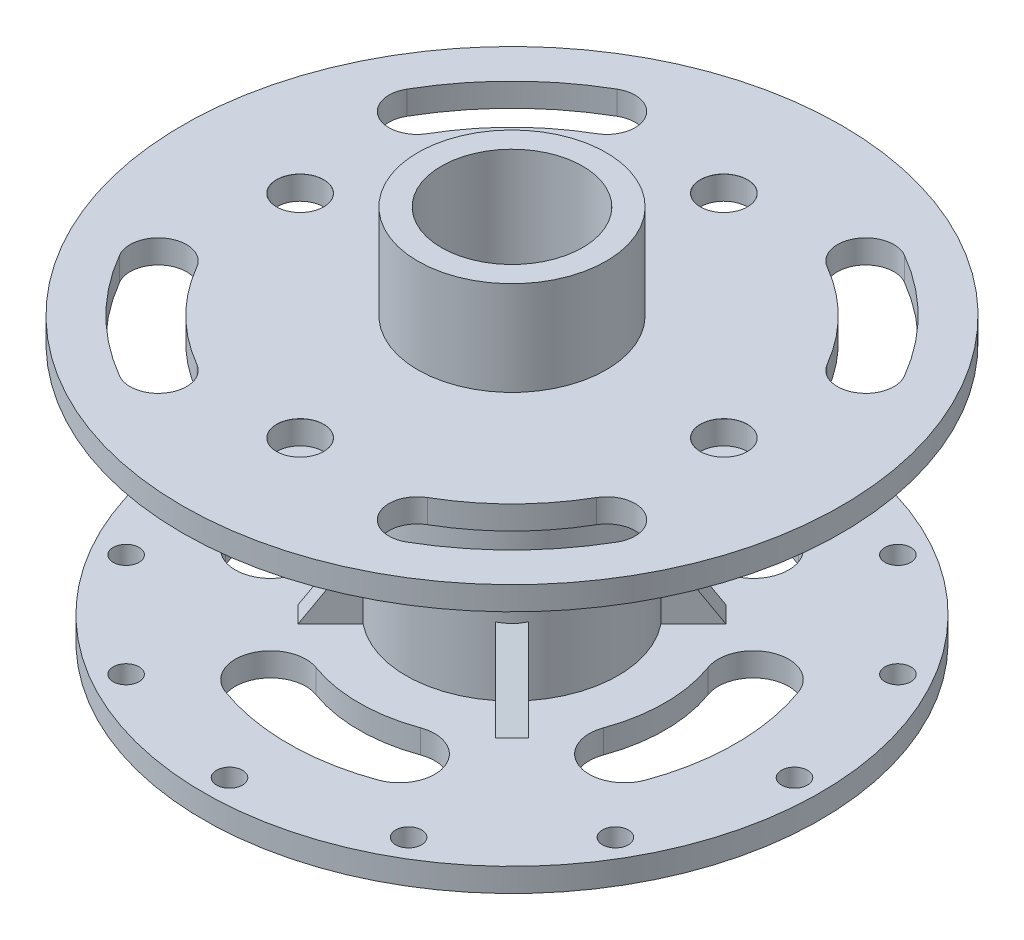
from build123d import *

# Parameters (mm, degrees)
SKETCH_1_R                        = 140
SKETCH_1_R_2                      = 30
EXTRUDE_1_DEPTH                   = 10
HOLE_WIZARD_20_0_20_1_AT_2_COUNT  = 2
HOLE_WIZARD_20_0_20_1_AT_2_PITCH  = 127.279220614
HOLE_WIZARD_20_0_20_1_AT_3_COUNT  = 2
HOLE_WIZARD_20_0_20_1_AT_3_PITCH  = 180
HOLE_WIZARD_20_0_20_1_AT_4_COUNT  = 2
HOLE_WIZARD_20_0_20_1_AT_4_PITCH  = 127.279220614
SKETCH_4_R                        = 40
SKETCH_4_R_2                      = 30
EXTRUDE_2_DEPTH                   = 40
EXTRUDE_START                     = -100
SKETCH_6_R                        = 45
SKETCH_6_R_2                      = 30
EXTRUDE_3_DEPTH                   = 100
RIB_6_REACH                       = 223.811
SKETCH_7_WALL_W                   = 483.06475071
SKETCH_7_WALL_H                   = 10
PATTERN_CIRCULAR_1_COUNT          = 4
SKETCH_8_R                        = 131
EXTRUDE_4_DEPTH                   = 10
HOLE_WIZARD_11_0_11_1_D           = 11
HOLE_WIZARD_11_0_11_1_DEPTH       = 10
HOLE_WIZARD_11_0_11_1_CSINK_D     = 11.05
HOLE_WIZARD_11_0_11_1_CSINK_ANGLE = 90
RIB_7_REACH                       = 228.495
SKETCH_11_WALL_W                  = 492.43335657
SKETCH_11_WALL_H                  = 10
PATTERN_CIRCULAR_2_COUNT          = 4


with BuildPart() as part:
    # 草图1 → 凸台-拉伸1 (new body)
    with BuildSketch(Plane(origin=(0, 0, 0), x_dir=(1, 0, 0), z_dir=(0, 1, 0))):
        with Locations(Location((0, 0, 0), (0, 0, 270))):
            Circle(SKETCH_1_R)
        with Locations(Location((0, 0, 0), (0, 0, 270))):
            Circle(SKETCH_1_R_2, mode=Mode.SUBTRACT)
        with BuildLine():
            ThreePointArc((105.655099262, 61), (86.267027305, 86.267027305), (61, 105.655099262))
            ThreePointArc((61, 105.655099262), (44.607695155, 101.262794416), (49, 84.870489571))
            ThreePointArc((49, 84.870489571), (69.296464556, 69.296464556), (84.870489571, 49))
            ThreePointArc((84.870489571, 49), (101.262794416, 44.607695155), (105.655099262, 61))
        make_face(mode=Mode.SUBTRACT)
        with BuildLine():
            ThreePointArc((61, -105.655099262), (86.267027305, -86.267027305), (105.655099262, -61))
            ThreePointArc((105.655099262, -61), (101.262794416, -44.607695155), (84.870489571, -49))
            ThreePointArc((84.870489571, -49), (69.296464556, -69.296464556), (49, -84.870489571))
            ThreePointArc((49, -84.870489571), (44.607695155, -101.262794416), (61, -105.655099262))
        make_face(mode=Mode.SUBTRACT)
        with BuildLine():
            ThreePointArc((-105.655099262, -61), (-86.267027305, -86.267027305), (-61, -105.655099262))
            ThreePointArc((-61, -105.655099262), (-44.607695155, -101.262794416), (-49, -84.870489571))
            ThreePointArc((-49, -84.870489571), (-69.296464556, -69.296464556), (-84.870489571, -49))
            ThreePointArc((-84.870489571, -49), (-101.262794416, -44.607695155), (-105.655099262, -61))
        make_face(mode=Mode.SUBTRACT)
        with BuildLine():
            ThreePointArc((-61, 105.655099262), (-86.267027305, 86.267027305), (-105.655099262, 61))
            ThreePointArc((-105.655099262, 61), (-101.262794416, 44.607695155), (-84.870489571, 49))
            ThreePointArc((-84.870489571, 49), (-69.296464556, 69.296464556), (-49, 84.870489571))
            ThreePointArc((-49, 84.870489571), (-44.607695155, 101.262794416), (-61, 105.655099262))
        make_face(mode=Mode.SUBTRACT)
    extrude(amount=EXTRUDE_1_DEPTH)

    # 草图3 → Ø20.0 (20) 直径孔1 (revolve, cut)
    with BuildSketch(Plane(origin=(0, 10, 90), x_dir=(0, 0, 1), z_dir=(1, 0, 0))):
        Polygon((0, 0), (0, 10), (10, 10), (10, 0.025), (10.025, 0), align=None)
    hole_wizard_20_0_20_1 = revolve(axis=Axis((0, 16.35, 90), (0, -1, 0)), mode=Mode.SUBTRACT)

    # Ø20.0 (20) 直径孔1 at 2: Ø20.0 (20) 直径孔1 ×2
    with Locations(*[Vector(0.7071067811865476, 0, -0.7071067811865476) * (i * HOLE_WIZARD_20_0_20_1_AT_2_PITCH) for i in range(1, HOLE_WIZARD_20_0_20_1_AT_2_COUNT)]):
        add(hole_wizard_20_0_20_1, mode=Mode.SUBTRACT)

    # Ø20.0 (20) 直径孔1 at 3: Ø20.0 (20) 直径孔1 ×2
    with Locations(*[(0, 0, -i * HOLE_WIZARD_20_0_20_1_AT_3_PITCH) for i in range(1, HOLE_WIZARD_20_0_20_1_AT_3_COUNT)]):
        add(hole_wizard_20_0_20_1, mode=Mode.SUBTRACT)

    # Ø20.0 (20) 直径孔1 at 4: Ø20.0 (20) 直径孔1 ×2
    with Locations(*[Vector(-0.7071067811865476, 0, -0.7071067811865476) * (i * HOLE_WIZARD_20_0_20_1_AT_4_PITCH) for i in range(1, HOLE_WIZARD_20_0_20_1_AT_4_COUNT)]):
        add(hole_wizard_20_0_20_1, mode=Mode.SUBTRACT)

    # 草图4 → 凸台-拉伸2 (add)
    with BuildSketch(Plane(origin=(0, 10, 0), x_dir=(1, 0, 0), z_dir=(0, 1, 0))):
        with Locations(Location((0, 0, 0), (0, 0, 270))):
            Circle(SKETCH_4_R)
        with Locations(Location((0, 0, 0), (0, 0, 270))):
            Circle(SKETCH_4_R_2, mode=Mode.SUBTRACT)
    extrude(amount=EXTRUDE_2_DEPTH)

    # 草图6 → 凸台-拉伸3 (add)
    with BuildSketch(Plane(origin=(0, 0, 0), x_dir=(1, 0, 0), z_dir=(0, 1, 0)).offset(EXTRUDE_START)):
        with Locations(Location((0, 0, 0), (0, 0, 270))):
            Circle(SKETCH_6_R)
        with Locations(Location((0, 0, 0), (0, 0, 270))):
            Circle(SKETCH_6_R_2, mode=Mode.SUBTRACT)
    extrude(amount=EXTRUDE_3_DEPTH)

    # 草图7 wall → 筋6 (add, up to next)
    with BuildSketch(Plane(origin=(38.537319575, -14.5, 38.537319575), x_dir=(-0.396579526667, -0.827918690487, -0.396579526667), z_dir=(0.585426920314, -0.560848145172, 0.585426920314)), mode=Mode.PRIVATE) as rib_6_sk1:
        Rectangle(SKETCH_7_WALL_W, SKETCH_7_WALL_H)
    rib_6_tool1 = extrude(rib_6_sk1.sketch, amount=-RIB_6_REACH, mode=Mode.PRIVATE) - part.part
    rib_6 = rib_6_tool1.solids().sort_by_distance((38.537319575, -14.5, 38.537319575))[0]
    add(rib_6)

    # 阵列(圆周)1: 筋6 ×4 about axis
    pattern_circular_1_axis = Axis((0, 0, 0), (0, 1, 0))
    for i in range(1, PATTERN_CIRCULAR_1_COUNT):
        add(rib_6.rotate(pattern_circular_1_axis, i * 360 / PATTERN_CIRCULAR_1_COUNT))

    # 草图8 → 凸台-拉伸4 (add)
    with BuildSketch(Plane.XZ.offset(100)):
        with Locations(Location((0, 0, 0), (0, 0, 270))):
            Circle(SKETCH_8_R)
        with BuildLine():
            ThreePointArc((32.491913616, 89.270798975), (0, 95), (-32.491913616, 89.270798975))
            ThreePointArc((-32.491913616, 89.270798975), (-41.457000778, 70.045107513), (-22.231309316, 61.080020351))
            ThreePointArc((-22.231309316, 61.080020351), (0, 65), (22.231309316, 61.080020351))
            ThreePointArc((22.231309316, 61.080020351), (41.457000778, 70.045107513), (32.491913616, 89.270798975))
        make_face(mode=Mode.SUBTRACT)
        with BuildLine():
            ThreePointArc((89.270798975, -32.491913616), (95, 0), (89.270798975, 32.491913616))
            ThreePointArc((89.270798975, 32.491913616), (70.045107513, 41.457000778), (61.080020351, 22.231309316))
            ThreePointArc((61.080020351, 22.231309316), (65, 0), (61.080020351, -22.231309316))
            ThreePointArc((61.080020351, -22.231309316), (70.045107513, -41.457000778), (89.270798975, -32.491913616))
        make_face(mode=Mode.SUBTRACT)
        with BuildLine():
            ThreePointArc((-32.491913616, -89.270798975), (0, -95), (32.491913616, -89.270798975))
            ThreePointArc((32.491913616, -89.270798975), (41.457000778, -70.045107513), (22.231309316, -61.080020351))
            ThreePointArc((22.231309316, -61.080020351), (0, -65), (-22.231309316, -61.080020351))
            ThreePointArc((-22.231309316, -61.080020351), (-41.457000778, -70.045107513), (-32.491913616, -89.270798975))
        make_face(mode=Mode.SUBTRACT)
        with BuildLine():
            ThreePointArc((-89.270798975, 32.491913616), (-95, 0), (-89.270798975, -32.491913616))
            ThreePointArc((-89.270798975, -32.491913616), (-70.045107513, -41.457000778), (-61.080020351, -22.231309316))
            ThreePointArc((-61.080020351, -22.231309316), (-65, 0), (-61.080020351, 22.231309316))
            ThreePointArc((-61.080020351, 22.231309316), (-70.045107513, 41.457000778), (-89.270798975, 32.491913616))
        make_face(mode=Mode.SUBTRACT)
    extrude(amount=EXTRUDE_4_DEPTH)

    # Ø11.0 (11) 直径孔1
    with Locations(Plane.XZ.offset(110)):
        with Locations((0, 0), (0, 120), (60, 103.923048454), (103.923048454, 60), (120, 0), (103.923048454, -60), (60, -103.923048454), (0, -120), (-60, -103.923048454), (-103.923048454, -60), (-120, 0), (-103.923048454, 60), (-60, 103.923048454)):
            CounterSinkHole(HOLE_WIZARD_11_0_11_1_D / 2, HOLE_WIZARD_11_0_11_1_CSINK_D / 2, depth=HOLE_WIZARD_11_0_11_1_DEPTH, counter_sink_angle=HOLE_WIZARD_11_0_11_1_CSINK_ANGLE)

    # 草图11 wall → 筋7 (add, up to next)
    with BuildSketch(Plane(origin=(38.537319575, -85.5, 38.537319575), x_dir=(0.396579526667, -0.827918690487, 0.396579526667), z_dir=(0.585426920314, 0.560848145172, 0.585426920314)), mode=Mode.PRIVATE) as rib_7_sk1:
        Rectangle(SKETCH_11_WALL_W, SKETCH_11_WALL_H)
    rib_7_tool1 = extrude(rib_7_sk1.sketch, amount=-RIB_7_REACH, mode=Mode.PRIVATE) - part.part
    rib_7 = rib_7_tool1.solids().sort_by_distance((38.537319575, -85.5, 38.537319575))[0]
    add(rib_7)

    # 阵列(圆周)2: 筋7 ×4 about axis
    pattern_circular_2_axis = Axis((0, 0, 0), (0, 1, 0))
    for i in range(1, PATTERN_CIRCULAR_2_COUNT):
        add(rib_7.rotate(pattern_circular_2_axis, i * 360 / PATTERN_CIRCULAR_2_COUNT))


solid = part.part
